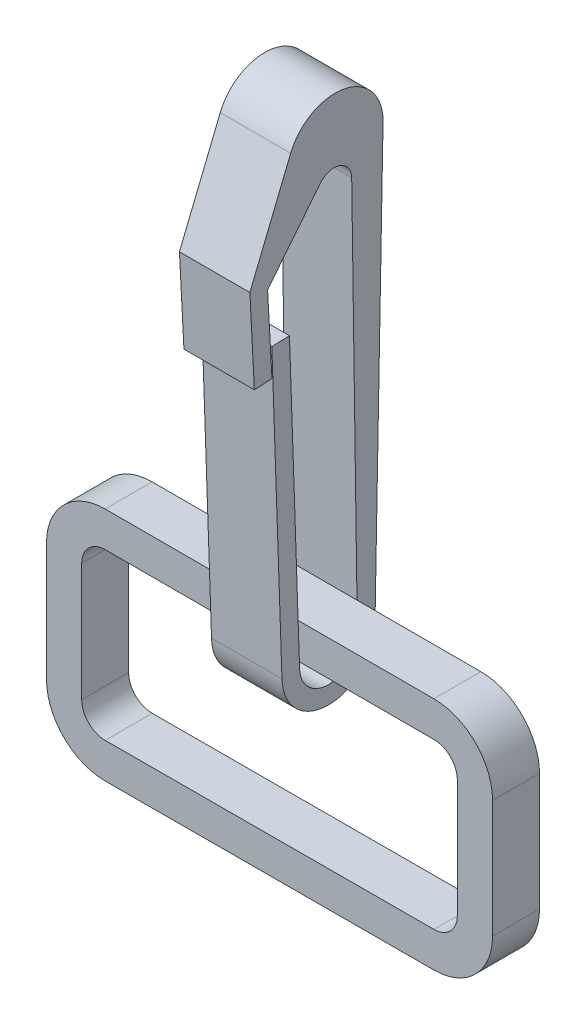
from build123d import *

# Parameters (mm, degrees)
EXTRUSION1_DEPTH      = 4
EXTRUSION6_DEPTH      = 3
EXTRUSION6_DEPTH_BACK = 3


with BuildPart() as part:
    # Esquisse1 → Extrusion1 (new body)
    with BuildSketch(Plane.XY):
        with BuildLine():
            Line((5.010293101, 0.010314313), (33.010212581, 0.067955638))
            ThreePointArc((33.010212581, 0.067955638), (36.539090675, 1.536052173), (37.999919479, 5.067945043))
            Line((37.999919479, 5.067945043), (37.999919479, 15.078227571))
            ThreePointArc((37.999919479, 15.078227571), (36.535453385, 18.613761477), (32.999919479, 20.078227571))
            Line((32.999919479, 20.078227571), (5, 20.078227571))
            ThreePointArc((5, 20.078227571), (1.464466094, 18.613761477), (0, 15.078227571))
            Line((0, 15.078227571), (0, 5.010303718))
            ThreePointArc((0, 5.010303718), (1.46810713, 1.471132522), (5.010293101, 0.010314313))
        make_face()
        with BuildLine():
            Line((5.004117241, 3.010307956), (33.00403672, 3.067949281))
            ThreePointArc((33.00403672, 3.067949281), (34.415587958, 3.655187895), (34.999919479, 5.067945043))
            Line((34.999919479, 5.067945043), (34.999919479, 15.078227571))
            ThreePointArc((34.999919479, 15.078227571), (34.414133042, 16.492441133), (32.999919479, 17.078227571))
            Line((32.999919479, 17.078227571), (5, 17.078227571))
            ThreePointArc((5, 17.078227571), (3.585786438, 16.492441133), (3, 15.078227571))
            Line((3, 15.078227571), (3, 5.010303718))
            ThreePointArc((3, 5.010303718), (3.587242852, 3.59463524), (5.004117241, 3.010307956))
        make_face(mode=Mode.SUBTRACT)
    extrude(amount=EXTRUSION1_DEPTH)


with BuildPart() as body_2:
    # Esquisse3 → Extrusion6 (new, two sides: drawn at the far end of the back side and taken through both)
    with BuildSketch(Plane(origin=(18.99995974, 0, 0), x_dir=(0, 0, -1), z_dir=(1, 0, 0)).offset(-EXTRUSION6_DEPTH_BACK)):
        with BuildLine():
            Line((-4.439973035, 17.04696415), (-5.301833954, 42.016529803))
            Line((-5.301833954, 42.016529803), (-6.800941213, 41.964785933))
            Line((-6.800941213, 41.964785933), (-5.939658597, 17.011974715))
            ThreePointArc((-5.939658597, 17.011974715), (-1.903276121, 13.107411753), (1.984447776, 17.160015646))
            Line((1.984447776, 17.160015646), (2.669598886, 53.748061856))
            ThreePointArc((2.669598886, 53.748061856), (-0.565594436, 57.875653406), (-5.199339475, 55.419661805))
            Line((-5.199339475, 55.419661805), (-8.673308706, 46.888957693))
            Line((-8.673308706, 46.888957693), (-8.291007805, 39.51874277))
            Line((-8.291007805, 39.51874277), (-6.793021698, 39.596444905))
            Line((-6.793021698, 39.596444905), (-7.164629397, 46.331105448))
            Line((-7.164629397, 46.331105448), (-2.67078462, 51.942044927))
            ThreePointArc((-2.67078462, 51.942044927), (-1.013234058, 52.423177555), (-0.000153484, 51.025812098))
            Line((-0.000153484, 51.025812098), (0.484839133, 17.125753187))
            ThreePointArc((0.484839133, 17.125753187), (-1.937901786, 14.60703548), (-4.439973035, 17.04696415))
        make_face()
    extrude(amount=EXTRUSION6_DEPTH + EXTRUSION6_DEPTH_BACK)


solid = Compound([part.part, body_2.part])
